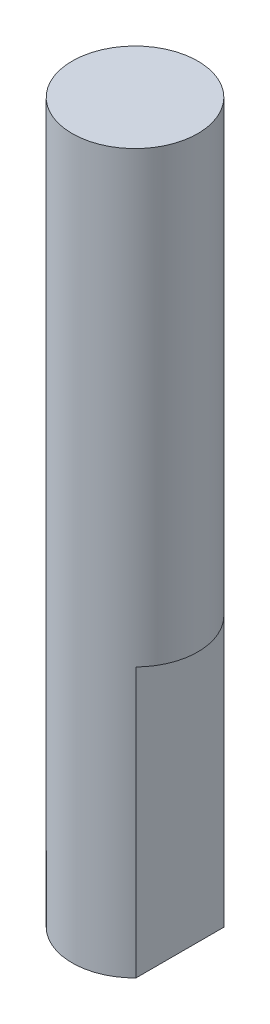
from build123d import *

# Parameters (mm, degrees)
SKETCH1_R           = 7
BOSS_EXTRUDE1_DEPTH = 80
CUT_EXTRUDE1_DEPTH  = 30


with BuildPart() as part:
    # Sketch1 → Boss-Extrude1 (new body)
    with BuildSketch(Plane(origin=(0, 0, 0), x_dir=(1, 0, 0), z_dir=(0, 1, 0))):
        with Locations(Location((0, 0, 0), (0, 0, 270))):
            Circle(SKETCH1_R)
    extrude(amount=BOSS_EXTRUDE1_DEPTH)

    # Sketch2 → Cut-Extrude1 (cut)
    with BuildSketch(Plane.XZ):
        with BuildLine():
            Line((-5, 4.898979486), (-5, -4.898979486))
            ThreePointArc((-5, -4.898979486), (-7, 0), (-5, 4.898979486))
        make_face()
        with BuildLine():
            Line((5, 4.898979486), (5, -4.898979486))
            ThreePointArc((5, -4.898979486), (7, 0), (5, 4.898979486))
        make_face()
    extrude(amount=-CUT_EXTRUDE1_DEPTH, mode=Mode.SUBTRACT)


solid = part.part
